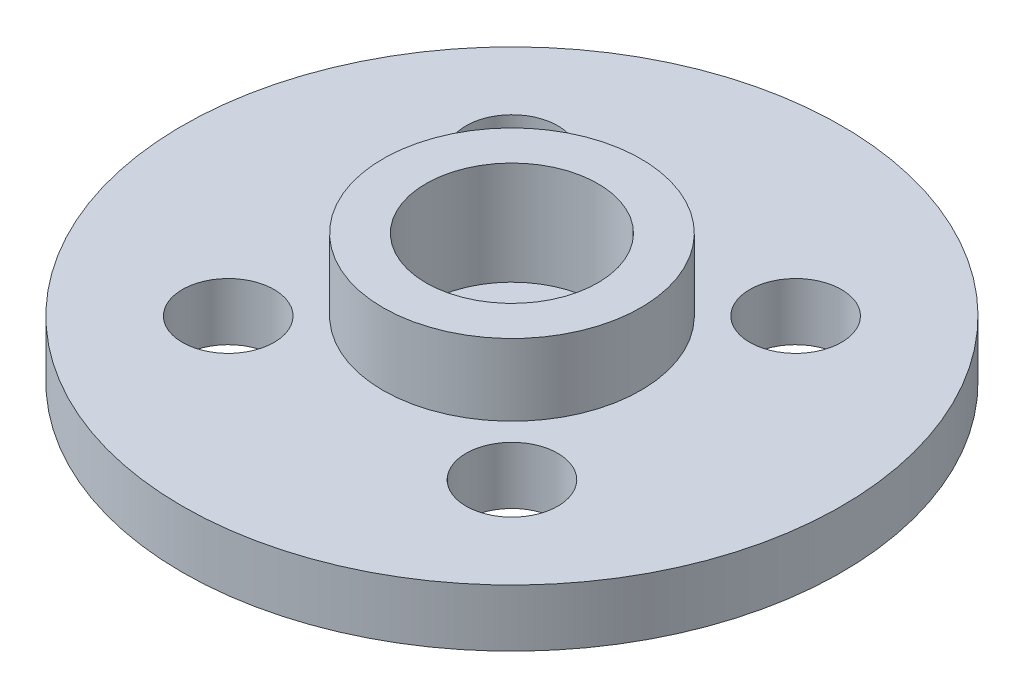
from build123d import *

# Parameters (mm, degrees)
SKETCH1_R           = 11.5
SKETCH1_R_2         = 1.6
BOSS_EXTRUDE1_DEPTH = 2
SKETCH2_R           = 4.5
SKETCH2_R_2         = 1.6
BOSS_EXTRUDE2_DEPTH = 2.5
SKETCH3_R           = 3
CUT_EXTRUDE1_DEPTH  = 3.6


with BuildPart() as part:
    # Sketch1 → Boss-Extrude1 (new body)
    with BuildSketch(Plane(origin=(0, 0, 0), x_dir=(1, 0, 0), z_dir=(0, 1, 0))):
        Circle(SKETCH1_R)
        with Locations((-4.949747468, 4.949747468)):
            Circle(SKETCH1_R_2, mode=Mode.SUBTRACT)
        with Locations((4.949747468, 4.949747468)):
            Circle(SKETCH1_R_2, mode=Mode.SUBTRACT)
        with Locations((4.949747468, -4.949747468)):
            Circle(SKETCH1_R_2, mode=Mode.SUBTRACT)
        with Locations((-4.949747468, -4.949747468)):
            Circle(SKETCH1_R_2, mode=Mode.SUBTRACT)
        Circle(SKETCH1_R_2, mode=Mode.SUBTRACT)
    extrude(amount=BOSS_EXTRUDE1_DEPTH)

    # Sketch2 → Boss-Extrude2 (add)
    with BuildSketch(Plane(origin=(0, 2, 0), x_dir=(1, 0, 0), z_dir=(0, 1, 0))):
        Circle(SKETCH2_R)
        Circle(SKETCH2_R_2, mode=Mode.SUBTRACT)
    extrude(amount=BOSS_EXTRUDE2_DEPTH)

    # Sketch3 → Cut-Extrude1 (cut)
    with BuildSketch(Plane(origin=(0, 4.5, 0), x_dir=(1, 0, 0), z_dir=(0, 1, 0))):
        Circle(SKETCH3_R)
    extrude(amount=-CUT_EXTRUDE1_DEPTH, mode=Mode.SUBTRACT)


solid = part.part
